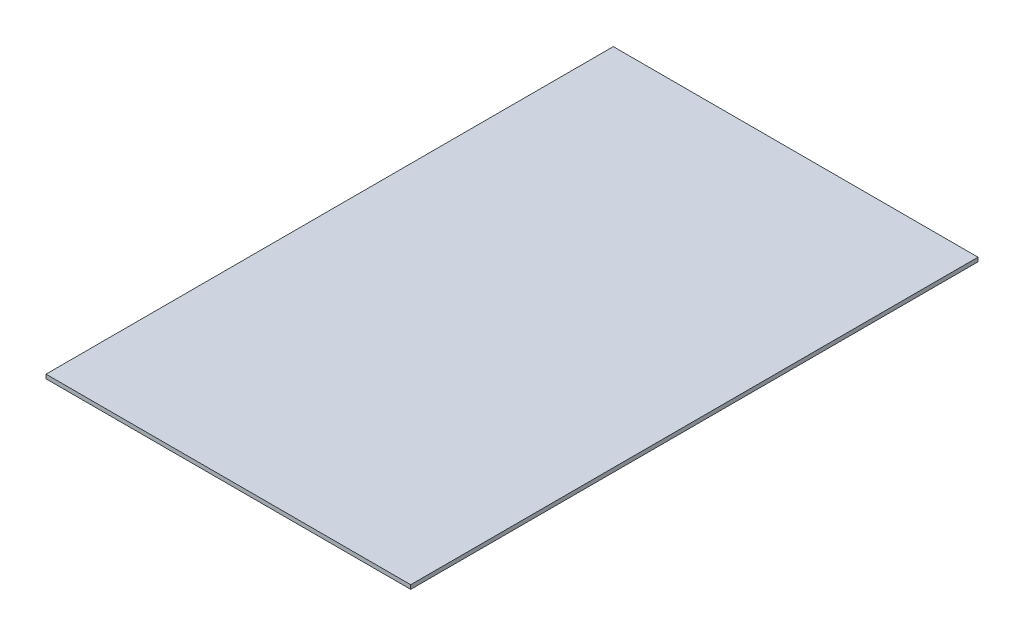
from build123d import *

# Parameters (mm, degrees)
SKETCH_1_W      = 180
SKETCH_1_H      = 280
EXTRUDE_1_DEPTH = 2


with BuildPart() as part:
    # 草图1 → 凸台-拉伸1 (new body)
    with BuildSketch(Plane(origin=(0, 0, 0), x_dir=(1, 0, 0), z_dir=(0, 1, 0))):
        with Locations((90, -140)):
            Rectangle(SKETCH_1_W, SKETCH_1_H)
    extrude(amount=EXTRUDE_1_DEPTH)


solid = part.part
